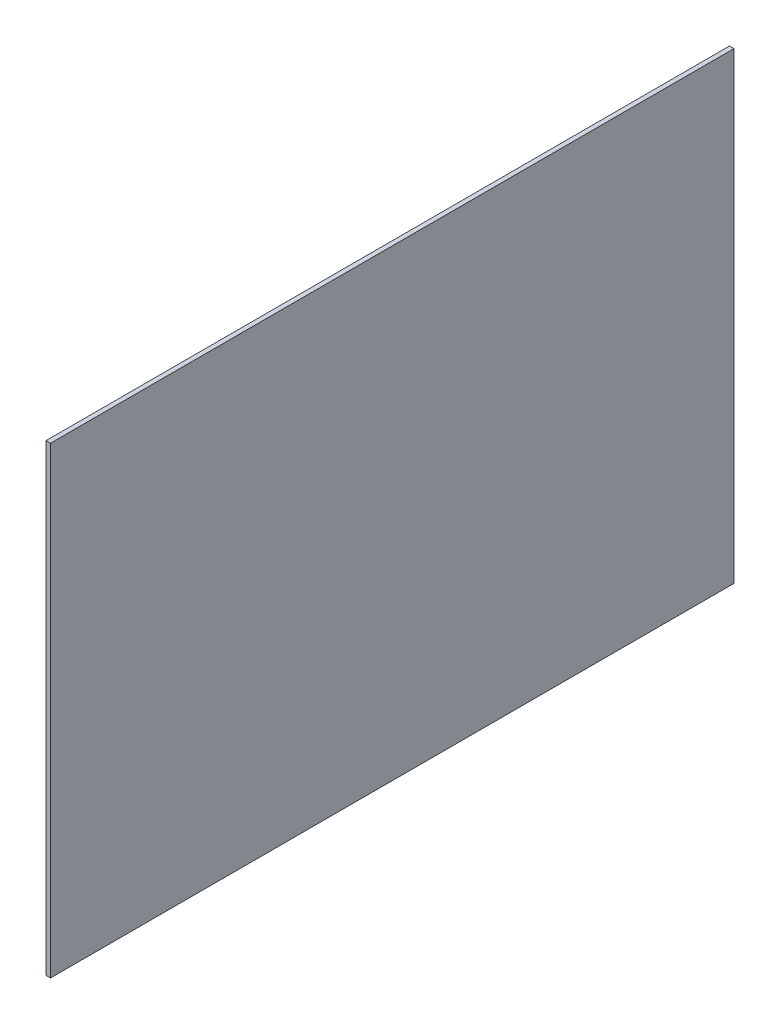
from build123d import *

# Parameters (mm, degrees)
SKETCH1_W           = 457.2
SKETCH1_H           = 309.8
BOSS_EXTRUDE1_DEPTH = 3


with BuildPart() as part:
    # Sketch1 → Boss-Extrude1 (new body)
    with BuildSketch(Plane(origin=(0, 0, 0), x_dir=(0, 0, -1), z_dir=(1, 0, 0))):
        Rectangle(SKETCH1_W, SKETCH1_H)
    extrude(amount=BOSS_EXTRUDE1_DEPTH)


solid = part.part
